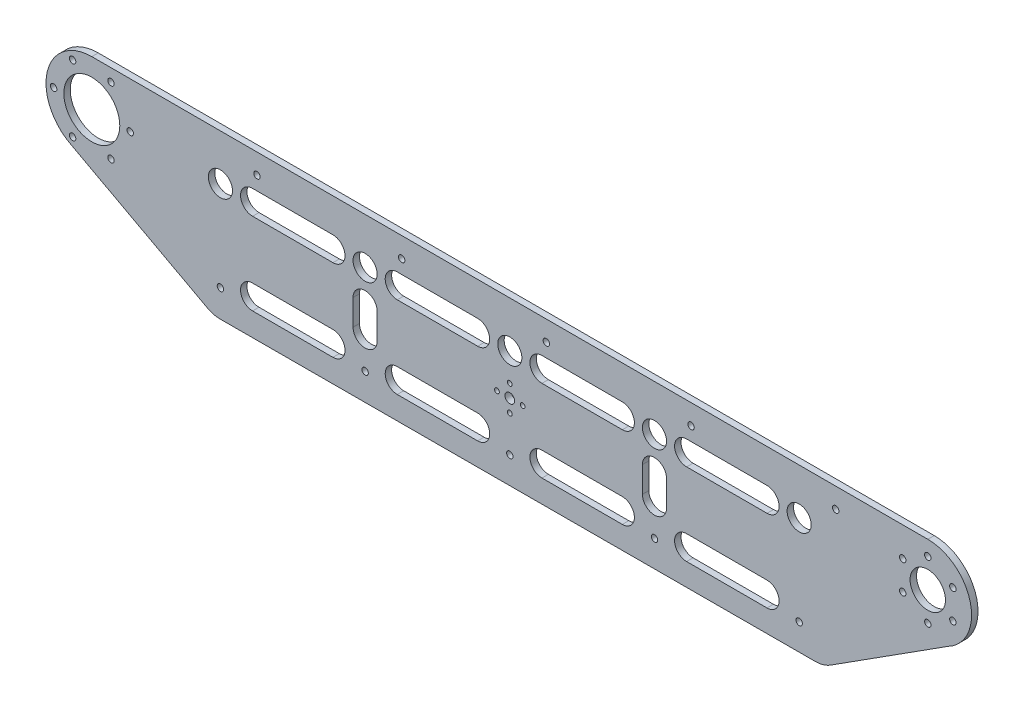
from build123d import *

# Parameters (mm, degrees)
CROQUIS1_R              = 2
CROQUIS1_R_2            = 7.5
CROQUIS1_R_3            = 17.4
CROQUIS1_R_4            = 11
CROQUIS1_R_5            = 1.5
CROQUIS1_R_6            = 3
SALIENTE_EXTRUIR1_DEPTH = 2
CROQUIS2_R              = 2
CORTAR_EXTRUIR1_DEPTH   = 10
CROQUIS3_R              = 2
CORTAR_EXTRUIR2_DEPTH   = 10
CROQUIS4_R              = 2
CORTAR_EXTRUIR3_DEPTH   = 10


with BuildPart() as part:
    # Croquis1 → Saliente-Extruir1 (new, symmetric)
    with BuildSketch(Plane.XY):
        with BuildLine():
            Line((-178.895080774, -40.856503162), (179.195612521, -40.220204958))
            Line((179.195612521, -40.220204958), (190.010789857, -40.220204958))
            ThreePointArc((190.010789857, -40.220204958), (194.944809403, -39.514865591), (199.483580997, -37.455349889))
            Line((199.483580997, -37.455349889), (272.742664287, 9.291785175))
            ThreePointArc((272.742664287, 9.291785175), (286.437106864, 39.932371901), (260, 60.607542834))
            Line((260, 60.607542834), (-260, 60.607542834))
            ThreePointArc((-260, 60.607542834), (-287.659968635, 38.976031395), (-273.332082679, 6.918148807))
            Line((-273.332082679, 6.918148807), (-188.316697637, -38.71919799))
            ThreePointArc((-188.316697637, -38.71919799), (-183.7609115, -40.471216098), (-178.895080774, -40.856503162))
        make_face()
        with Locations((0, -23.892457166)):
            Circle(CROQUIS1_R, mode=Mode.SUBTRACT)
        with Locations((-90, -23.892457166)):
            Circle(CROQUIS1_R, mode=Mode.SUBTRACT)
        with Locations((-180, -23.892457166)):
            Circle(CROQUIS1_R, mode=Mode.SUBTRACT)
        with Locations((-90, 32.107542834)):
            Circle(CROQUIS1_R_2, mode=Mode.SUBTRACT)
        with Locations((0, 32.107542834)):
            Circle(CROQUIS1_R_2, mode=Mode.SUBTRACT)
        with Locations((-260, 32.107542834)):
            Circle(CROQUIS1_R_3, mode=Mode.SUBTRACT)
        with Locations(Location((260, 33.367542834, 0), (0, 0, 180))):
            Circle(CROQUIS1_R_4, mode=Mode.SUBTRACT)
        with Locations(Location((90, 32.107542834, 0), (0, 0, 180))):
            Circle(CROQUIS1_R_2, mode=Mode.SUBTRACT)
        with Locations(Location((90, -23.892457166, 0), (0, 0, 180))):
            Circle(CROQUIS1_R, mode=Mode.SUBTRACT)
        with Locations(Location((-180, 32.107542834, 0), (0, 0, 180))):
            Circle(CROQUIS1_R_2, mode=Mode.SUBTRACT)
        with Locations((180, 32.107542834)):
            Circle(CROQUIS1_R_2, mode=Mode.SUBTRACT)
        with Locations((-8, 6.607542834)):
            Circle(CROQUIS1_R_5, mode=Mode.SUBTRACT)
        with Locations((0, 14.607542834)):
            Circle(CROQUIS1_R_5, mode=Mode.SUBTRACT)
        with Locations((8, 6.607542834)):
            Circle(CROQUIS1_R_5, mode=Mode.SUBTRACT)
        with Locations((0, -1.392457166)):
            Circle(CROQUIS1_R_5, mode=Mode.SUBTRACT)
        with Locations((0, 6.607542834)):
            Circle(CROQUIS1_R_6, mode=Mode.SUBTRACT)
        with Locations((180, -23.892457166)):
            Circle(CROQUIS1_R, mode=Mode.SUBTRACT)
        with BuildLine():
            Line((-82.5, 12.107542834), (-82.5, -3.892457166))
            ThreePointArc((-82.5, -3.892457166), (-90, -11.392457166), (-97.5, -3.892457166))
            Line((-97.5, -3.892457166), (-97.5, 12.107542834))
            ThreePointArc((-97.5, 12.107542834), (-90, 19.607542834), (-82.5, 12.107542834))
        make_face(mode=Mode.SUBTRACT)
        with BuildLine():
            Line((-20, 24.607542834), (-70, 24.607542834))
            ThreePointArc((-70, 24.607542834), (-77.5, 32.107542834), (-70, 39.607542834))
            Line((-70, 39.607542834), (-20, 39.607542834))
            ThreePointArc((-20, 39.607542834), (-12.5, 32.107542834), (-20, 24.607542834))
        make_face(mode=Mode.SUBTRACT)
        with BuildLine():
            Line((160, -26.392457166), (110, -26.392457166))
            ThreePointArc((110, -26.392457166), (102.5, -18.892457166), (110, -11.392457166))
            Line((110, -11.392457166), (160, -11.392457166))
            ThreePointArc((160, -11.392457166), (167.5, -18.892457166), (160, -26.392457166))
        make_face(mode=Mode.SUBTRACT)
        with BuildLine():
            Line((20, -11.392457166), (70, -11.392457166))
            ThreePointArc((70, -11.392457166), (77.5, -18.892457166), (70, -26.392457166))
            Line((70, -26.392457166), (20, -26.392457166))
            ThreePointArc((20, -26.392457166), (12.5, -18.892457166), (20, -11.392457166))
        make_face(mode=Mode.SUBTRACT)
        with BuildLine():
            Line((20, 39.607542834), (70, 39.607542834))
            ThreePointArc((70, 39.607542834), (77.5, 32.107542834), (70, 24.607542834))
            Line((70, 24.607542834), (20, 24.607542834))
            ThreePointArc((20, 24.607542834), (12.5, 32.107542834), (20, 39.607542834))
        make_face(mode=Mode.SUBTRACT)
        with BuildLine():
            Line((-160, 39.607542834), (-110, 39.607542834))
            ThreePointArc((-110, 39.607542834), (-102.5, 32.107542834), (-110, 24.607542834))
            Line((-110, 24.607542834), (-160, 24.607542834))
            ThreePointArc((-160, 24.607542834), (-167.5, 32.107542834), (-160, 39.607542834))
        make_face(mode=Mode.SUBTRACT)
        with BuildLine():
            Line((-20, -26.392457166), (-70, -26.392457166))
            ThreePointArc((-70, -26.392457166), (-77.5, -18.892457166), (-70, -11.392457166))
            Line((-70, -11.392457166), (-20, -11.392457166))
            ThreePointArc((-20, -11.392457166), (-12.5, -18.892457166), (-20, -26.392457166))
        make_face(mode=Mode.SUBTRACT)
        with BuildLine():
            Line((160, 24.607542834), (110, 24.607542834))
            ThreePointArc((110, 24.607542834), (102.5, 32.107542834), (110, 39.607542834))
            Line((110, 39.607542834), (160, 39.607542834))
            ThreePointArc((160, 39.607542834), (167.5, 32.107542834), (160, 24.607542834))
        make_face(mode=Mode.SUBTRACT)
        with BuildLine():
            Line((-160, -26.392457166), (-110, -26.392457166))
            ThreePointArc((-110, -26.392457166), (-102.5, -18.892457166), (-110, -11.392457166))
            Line((-110, -11.392457166), (-160, -11.392457166))
            ThreePointArc((-160, -11.392457166), (-167.5, -18.892457166), (-160, -26.392457166))
        make_face(mode=Mode.SUBTRACT)
        with BuildLine():
            Line((97.5, 12.107542834), (97.5, -3.892457166))
            ThreePointArc((97.5, -3.892457166), (90, -11.392457166), (82.5, -3.892457166))
            Line((82.5, -3.892457166), (82.5, 12.107542834))
            ThreePointArc((82.5, 12.107542834), (90, 19.607542834), (97.5, 12.107542834))
        make_face(mode=Mode.SUBTRACT)
    extrude(amount=SALIENTE_EXTRUIR1_DEPTH, both=True)

    # Croquis2 → Cortar-Extruir1 (cut)
    with BuildSketch(Plane.XY.offset(2)):
        with Locations((-283.74, 32.107542834)):
            Circle(CROQUIS2_R)
        with Locations((-271.95, 52.805549985)):
            Circle(CROQUIS2_R)
        with Locations((-248.05, 52.805549985)):
            Circle(CROQUIS2_R)
        with Locations((-236.1, 32.107542834)):
            Circle(CROQUIS2_R)
        with Locations((-248.05, 11.409535684)):
            Circle(CROQUIS2_R)
        with Locations((-271.95, 11.409535684)):
            Circle(CROQUIS2_R)
    extrude(amount=-CORTAR_EXTRUIR1_DEPTH, mode=Mode.SUBTRACT)

    # Croquis3 → Cortar-Extruir2 (cut)
    with BuildSketch(Plane.XY.offset(2)):
        with Locations((260, 51.367542834)):
            Circle(CROQUIS3_R)
        with Locations((275.588457268, 42.367542834)):
            Circle(CROQUIS3_R)
        with Locations((275.588457268, 24.367542834)):
            Circle(CROQUIS3_R)
        with Locations((260, 15.367542834)):
            Circle(CROQUIS3_R)
        with Locations((244.411542732, 24.367542834)):
            Circle(CROQUIS3_R)
        with Locations((244.411542732, 42.367542834)):
            Circle(CROQUIS3_R)
    extrude(amount=-CORTAR_EXTRUIR2_DEPTH, mode=Mode.SUBTRACT)

    # Croquis4 → Cortar-Extruir3 (cut)
    with BuildSketch(Plane.XY.offset(2)):
        with Locations((-157.256763594, 48.107542834)):
            Circle(CROQUIS4_R)
        with Locations((-67.256763594, 48.107542834)):
            Circle(CROQUIS4_R)
        with Locations((22.743236406, 48.107542834)):
            Circle(CROQUIS4_R)
        with Locations((112.743236406, 48.107542834)):
            Circle(CROQUIS4_R)
        with Locations((202.743236406, 48.107542834)):
            Circle(CROQUIS4_R)
    extrude(amount=-CORTAR_EXTRUIR3_DEPTH, mode=Mode.SUBTRACT)


solid = part.part
